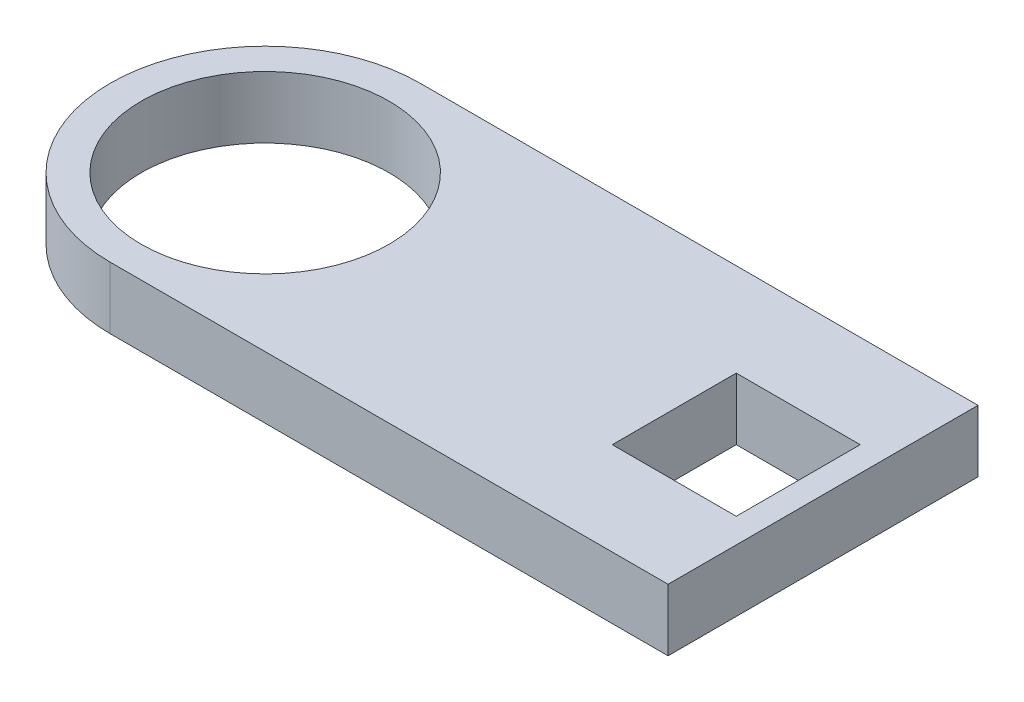
from build123d import *

# Parameters (mm, degrees)
SKETCH1_R           = 10
SKETCH1_W           = 10
SKETCH1_H           = 10
BOSS_EXTRUDE1_DEPTH = 5


with BuildPart() as part:
    # Sketch1 → Boss-Extrude1 (new body)
    with BuildSketch(Plane(origin=(0, 0, 0), x_dir=(1, 0, 0), z_dir=(0, 1, 0))):
        with BuildLine():
            Line((0, 0), (45, 0))
            Line((45, 0), (45, 25))
            Line((45, 25), (0, 25))
            ThreePointArc((0, 25), (-12.5, 12.5), (0, 0))
        make_face()
        with Locations(Location((0, 12.5, 0), (0, 0, 270))):
            Circle(SKETCH1_R, mode=Mode.SUBTRACT)
        with Locations((38, 12.5)):
            Rectangle(SKETCH1_W, SKETCH1_H, mode=Mode.SUBTRACT)
    extrude(amount=BOSS_EXTRUDE1_DEPTH)


solid = part.part
